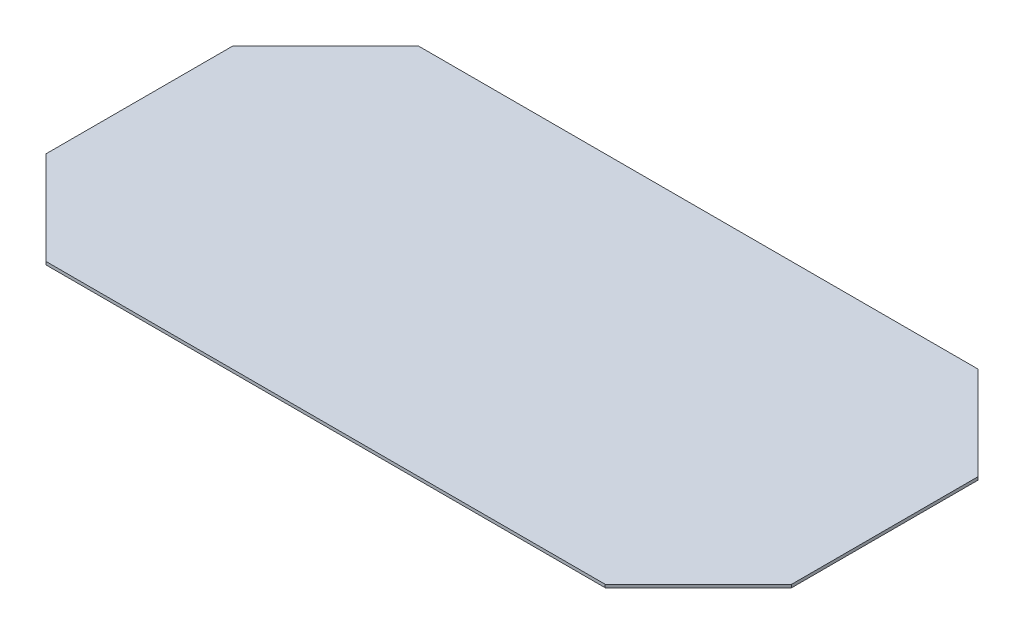
from build123d import *

# Parameters (mm, degrees)
SKETCH1_W           = 246.38
SKETCH1_H           = 123.19
BOSS_EXTRUDE1_DEPTH = 1
CHAMFER1_SIZE       = 30.7975


with BuildPart() as part:
    # Sketch1 → Boss-Extrude1 (new body)
    with BuildSketch(Plane(origin=(0, 0, 0), x_dir=(1, 0, 0), z_dir=(0, 1, 0))):
        Rectangle(SKETCH1_W, SKETCH1_H)
    extrude(amount=BOSS_EXTRUDE1_DEPTH)

    # Chamfer1
    chamfer1_edges = [part.edges().sort_by_distance(p)[0] for p in [
        (123.19, 0.5, 61.595),
        (-123.19, 0.5, 61.595),
        (-123.19, 0.5, -61.595),
        (123.19, 0.5, -61.595),
    ]]
    chamfer(chamfer1_edges, length=CHAMFER1_SIZE)


solid = part.part
